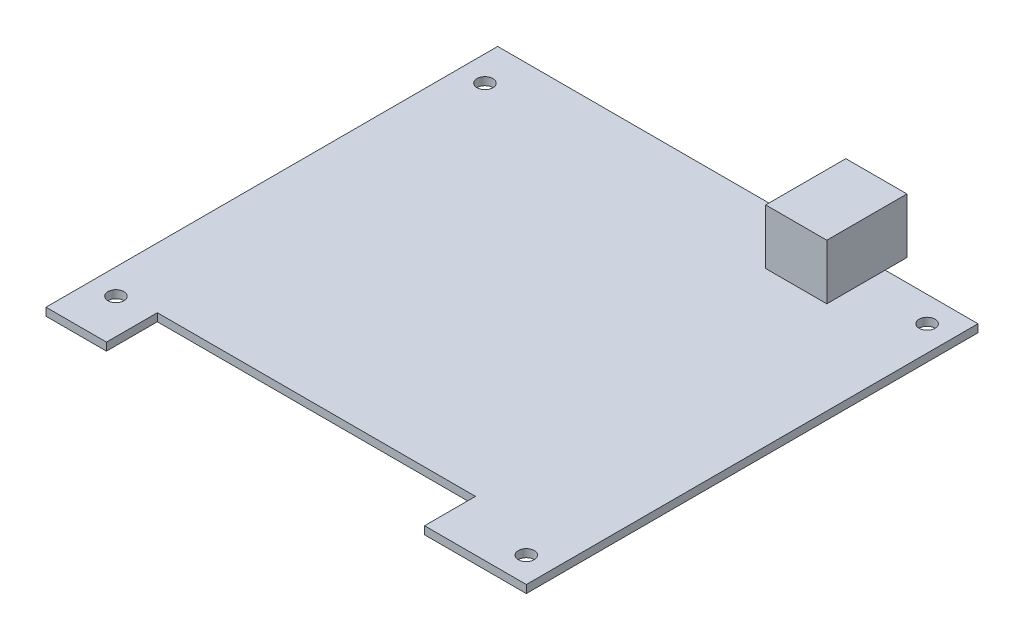
from build123d import *

# Parameters (mm, degrees)
BOSS_EXTRUDE1_DEPTH = 1.57
SKETCH2_R           = 1.59
CUT_EXTRUDE1_DEPTH  = 66.831946272
SKETCH3_W           = 12.2
SKETCH3_H           = 16
BOSS_EXTRUDE2_DEPTH = 11


with BuildPart() as part:
    # Sketch1 → Boss-Extrude1 (new body)
    with BuildSketch(Plane(origin=(0, 0, 0), x_dir=(1, 0, 0), z_dir=(0, 1, 0))):
        Polygon((-35.875, -45.085), (-47.945, -45.085), (-47.945, 45.085), (47.945, 45.085), (47.945, -45.085), (27.625, -45.085), (27.625, -34.925), (-35.875, -34.925), align=None)
    extrude(amount=BOSS_EXTRUDE1_DEPTH)

    # Sketch2 → Cut-Extrude1 (cut, through all)
    with BuildSketch(Plane(origin=(0, 1.57, 0), x_dir=(1, 0, 0), z_dir=(0, 1, 0))):
        with Locations(Location((42.865, -40.005, 0), (0, 0, 270))):
            Circle(SKETCH2_R)
        with Locations(Location((-42.865, -36.195, 0), (0, 0, 270))):
            Circle(SKETCH2_R)
        with Locations(Location((-42.865, 37.465, 0), (0, 0, 270))):
            Circle(SKETCH2_R)
        with Locations(Location((42.865, 40.005, 0), (0, 0, 270))):
            Circle(SKETCH2_R)
    extrude(amount=-CUT_EXTRUDE1_DEPTH, mode=Mode.SUBTRACT)


with BuildPart() as body_2:
    # Sketch3 → Boss-Extrude2 (new body)
    with BuildSketch(Plane(origin=(0, 1.57, 0), x_dir=(1, 0, 0), z_dir=(0, 1, 0))):
        with Locations((23.311, 41.435)):
            Rectangle(SKETCH3_W, SKETCH3_H)
    extrude(amount=BOSS_EXTRUDE2_DEPTH)


solid = Compound([part.part, body_2.part])
